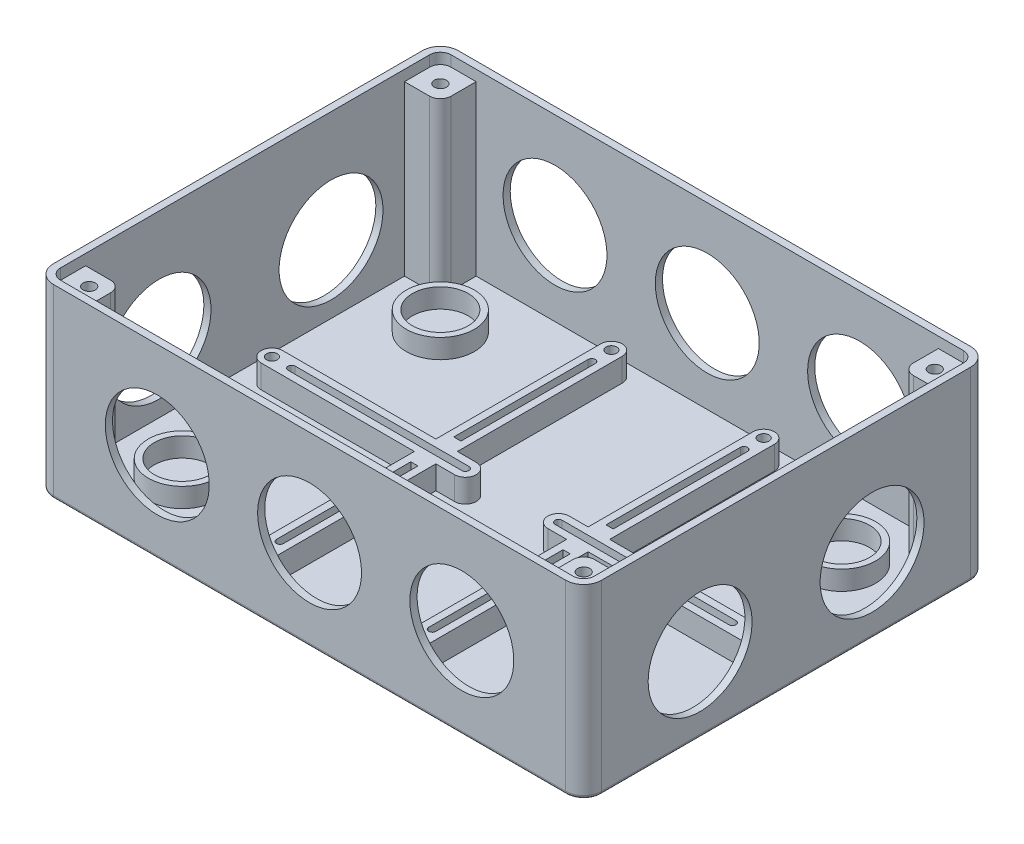
from build123d import *

# Parameters (mm, degrees)
BOSS_EXTRUDE1_DEPTH     = 52
FILLET1_R               = 1
SHELL1_T                = -2
SKETCH2_R               = 4
BOSS_EXTRUDE2_DEPTH     = 2.5
SKETCH3_R               = 14.5
CUT_EXTRUDE1_DEPTH      = 147.031674646
CUT_EXTRUDE2_DEPTH      = 109.390497739
CUT_EXTRUDE2_DEPTH_BACK = 109.390497739
SKETCH4_R               = 14.5
SKETCH5_W               = 93
SKETCH5_H               = 56
SKETCH5_W_2             = 89
SKETCH5_H_2             = 52
SKETCH5_W_3             = 61
SKETCH5_H_3             = 23
SKETCH5_W_4             = 57
SKETCH5_H_4             = 19
BOSS_EXTRUDE3_DEPTH     = 2.5
EXTRUDE_THIN1_START     = -2.5
EXTRUDE_THIN1_DEPTH     = 2.5
EXTRUDE_THIN2_START     = -2.5
EXTRUDE_THIN2_DEPTH     = 2.5
SKETCH8_R               = 9.5
SKETCH8_R_2             = 7.8
EXTRUDE_THIN3_DEPTH     = 5.4
SKETCH9_R               = 1.5
BOSS_EXTRUDE4_DEPTH     = 6.5
CUT_EXTRUDE3_DEPTH      = 6.5
CUT_EXTRUDE4_DEPTH      = 6.5
SKETCH12_R              = 1.7
BOSS_EXTRUDE5_DEPTH     = 47


with BuildPart() as part:
    # Sketch1 → Boss-Extrude1 (new body)
    with BuildSketch(Plane(origin=(0, 0, 0), x_dir=(1, 0, 0), z_dir=(0, 1, 0))):
        with BuildLine():
            Line((76.5, -51.5), (76.5, 51.5))
            ThreePointArc((76.5, 51.5), (75.035533906, 55.035533906), (71.5, 56.5))
            Line((71.5, 56.5), (-71.5, 56.5))
            ThreePointArc((-71.5, 56.5), (-75.035533906, 55.035533906), (-76.5, 51.5))
            Line((-76.5, 51.5), (-76.5, -51.5))
            ThreePointArc((-76.5, -51.5), (-75.035533906, -55.035533906), (-71.5, -56.5))
            Line((-71.5, -56.5), (71.5, -56.5))
            ThreePointArc((71.5, -56.5), (75.035533906, -55.035533906), (76.5, -51.5))
        make_face()
    extrude(amount=BOSS_EXTRUDE1_DEPTH)

    # Fillet1
    fillet1_edges = [part.edges().sort_by_distance(p)[0] for p in [
        (0, 0, -56.5),
        (75.035533906, 0, -55.035533906),
        (76.5, 0, 0),
        (75.035533906, 0, 55.035533906),
        (0, 0, 56.5),
        (-75.035533906, 0, 55.035533906),
        (-76.5, 0, 0),
        (-75.035533906, 0, -55.035533906),
    ]]
    fillet(fillet1_edges, radius=FILLET1_R)

    # Shell1
    shell1_openings = [part.faces().sort_by_distance(p)[0] for p in [
        (0, 52, 0),
    ]]
    offset(amount=SHELL1_T, openings=shell1_openings, kind=Kind.INTERSECTION)

    # Sketch2 → Boss-Extrude2 (add)
    with BuildSketch(Plane.XZ):
        with BuildLine():
            Line((56, 45), (-56, 45))
            ThreePointArc((-56, 45), (-62.363961031, 42.363961031), (-65, 36))
            Line((-65, 36), (-65, -36))
            ThreePointArc((-65, -36), (-62.363961031, -42.363961031), (-56, -45))
            Line((-56, -45), (56, -45))
            ThreePointArc((56, -45), (62.363961031, -42.363961031), (65, -36))
            Line((65, -36), (65, 36))
            ThreePointArc((65, 36), (62.363961031, 42.363961031), (56, 45))
        make_face()
        with Locations(Location((56, 36, 0), (0, 0, 270))):
            Circle(SKETCH2_R, mode=Mode.SUBTRACT)
        with Locations(Location((56, -36, 0), (0, 0, 90))):
            Circle(SKETCH2_R, mode=Mode.SUBTRACT)
        with Locations(Location((-56, -36, 0), (0, 0, 270))):
            Circle(SKETCH2_R, mode=Mode.SUBTRACT)
        with Locations(Location((-56, 36, 0), (0, 0, 90))):
            Circle(SKETCH2_R, mode=Mode.SUBTRACT)
        with BuildLine():
            Line((50.343145751, 43), (-50.343145751, 43))
            ThreePointArc((-50.343145751, 43), (-49.636038969, 29.636038969), (-63, 30.343145751))
            Line((-63, 30.343145751), (-63, -30.343145751))
            ThreePointArc((-63, -30.343145751), (-49.636038969, -29.636038969), (-50.343145751, -43))
            Line((-50.343145751, -43), (50.343145751, -43))
            ThreePointArc((50.343145751, -43), (49.636038969, -29.636038969), (63, -30.343145751))
            Line((63, -30.343145751), (63, 30.343145751))
            ThreePointArc((63, 30.343145751), (49.636038969, 29.636038969), (50.343145751, 43))
        make_face(mode=Mode.SUBTRACT)
    extrude(amount=BOSS_EXTRUDE2_DEPTH)

    # Sketch3 → Cut-Extrude1 (cut, through all)
    with BuildSketch(Plane(origin=(0, 0, -56.5), x_dir=(-1, 0, 0), z_dir=(0, 0, -1))):
        with Locations((-42.5, 25.3)):
            Circle(SKETCH3_R)
        with Locations((0, 25.3)):
            Circle(SKETCH3_R)
        with Locations((42.5, 25.3)):
            Circle(SKETCH3_R)
    extrude(amount=-CUT_EXTRUDE1_DEPTH, mode=Mode.SUBTRACT)

    # Sketch4 → Cut-Extrude2 (cut, two sides: drawn at the far end of the back side and taken through both)
    with BuildSketch(Plane(origin=(0, 0, 0), x_dir=(0, 0, -1), z_dir=(1, 0, 0)).offset(-CUT_EXTRUDE2_DEPTH_BACK)):
        with Locations((24, 21)):
            Circle(SKETCH4_R)
        with Locations(Location((-24, 21, 0), (0, 0, 180))):
            Circle(SKETCH4_R)
    extrude(amount=CUT_EXTRUDE2_DEPTH + CUT_EXTRUDE2_DEPTH_BACK, mode=Mode.SUBTRACT)

    # Sketch5 → Boss-Extrude3 (add)
    # profile 1 of 2: a face of its own
    with BuildSketch(Plane.XZ):
        Rectangle(SKETCH5_W, SKETCH5_H)
        Rectangle(SKETCH5_W_2, SKETCH5_H_2, mode=Mode.SUBTRACT)
    # profile 2 of 2: a face of its own
    with BuildSketch(Plane.XZ):
        Rectangle(SKETCH5_W_3, SKETCH5_H_3)
        Rectangle(SKETCH5_W_4, SKETCH5_H_4, mode=Mode.SUBTRACT)
    extrude(amount=BOSS_EXTRUDE3_DEPTH)

    # Sketch6 → Extrude-Thin1 (add)
    with BuildSketch(Plane.XZ.offset(2.5).offset(EXTRUDE_THIN1_START)):
        Polygon((29.193893241, 8.779922108), (53.813581674, 32.504349144), (52.425795192, 33.944504927), (27.806106759, 10.220077892), align=None)
    extrude_thin1 = extrude(amount=EXTRUDE_THIN1_DEPTH)

    # Sketch7 → Extrude-Thin2 (add)
    with BuildSketch(Plane.XZ.offset(2.5).offset(EXTRUDE_THIN2_START)):
        Polygon((27.806106759, -10.220077892), (52.425795192, -33.944504927), (53.813581674, -32.504349144), (29.193893241, -8.779922108), align=None)
    extrude_thin2 = extrude(amount=EXTRUDE_THIN2_DEPTH)

    # Mirror1: Extrude-Thin1, Extrude-Thin2 across plane
    add(extrude_thin1.mirror(Plane(origin=(0, 0, 0), x_dir=(0, 0, 1), z_dir=(1, 0, 0))))
    add(extrude_thin2.mirror(Plane(origin=(0, 0, 0), x_dir=(0, 0, 1), z_dir=(1, 0, 0))))

    # Sketch8 → Extrude-Thin3 (add)
    # profile 1 of 4: a face of its own
    with BuildSketch(Plane(origin=(0, 2, 0), x_dir=(1, 0, 0), z_dir=(0, 1, 0))):
        with Locations((56, 36)):
            Circle(SKETCH8_R)
        with Locations((56, 36)):
            Circle(SKETCH8_R_2, mode=Mode.SUBTRACT)
    # profile 2 of 4: a face of its own
    with BuildSketch(Plane(origin=(0, 2, 0), x_dir=(1, 0, 0), z_dir=(0, 1, 0))):
        with Locations((-56, 36)):
            Circle(SKETCH8_R)
        with Locations((-56, 36)):
            Circle(SKETCH8_R_2, mode=Mode.SUBTRACT)
    # profile 3 of 4: a face of its own
    with BuildSketch(Plane(origin=(0, 2, 0), x_dir=(1, 0, 0), z_dir=(0, 1, 0))):
        with Locations((56, -36)):
            Circle(SKETCH8_R)
        with Locations((56, -36)):
            Circle(SKETCH8_R_2, mode=Mode.SUBTRACT)
    # profile 4 of 4: a face of its own
    with BuildSketch(Plane(origin=(0, 2, 0), x_dir=(1, 0, 0), z_dir=(0, 1, 0))):
        with Locations((-56, -36)):
            Circle(SKETCH8_R)
        with Locations((-56, -36)):
            Circle(SKETCH8_R_2, mode=Mode.SUBTRACT)
    extrude(amount=EXTRUDE_THIN3_DEPTH)

    # Sketch9 → Boss-Extrude4 (add)
    # profile 1 of 2: a face of its own
    with BuildSketch(Plane(origin=(0, 2, 0), x_dir=(1, 0, 0), z_dir=(0, 1, 0))):
        with BuildLine():
            Line((13, 3), (18.25, 3))
            Line((18.25, 3), (18.25, 49))
            ThreePointArc((18.25, 49), (21.25, 52), (24.25, 49))
            Line((24.25, 49), (24.25, 3))
            Line((24.25, 3), (67, 3))
            ThreePointArc((67, 3), (70, 0), (67, -3))
            Line((67, -3), (24.25, -3))
            Line((24.25, -3), (24.25, -49))
            ThreePointArc((24.25, -49), (21.25, -52), (18.25, -49))
            Line((18.25, -49), (18.25, -3))
            Line((18.25, -3), (13, -3))
            ThreePointArc((13, -3), (10, 0), (13, 3))
        make_face()
        with Locations(Location((67, 0, 0), (0, 0, 90))):
            Circle(SKETCH9_R, mode=Mode.SUBTRACT)
        with Locations(Location((21.25, 49, 0), (0, 0, 90))):
            Circle(SKETCH9_R, mode=Mode.SUBTRACT)
        with Locations(Location((21.25, -49, 0), (0, 0, 90))):
            Circle(SKETCH9_R, mode=Mode.SUBTRACT)
    # profile 2 of 2: a face of its own
    with BuildSketch(Plane(origin=(0, 2, 0), x_dir=(1, 0, 0), z_dir=(0, 1, 0))):
        with BuildLine():
            Line((-24.25, -3), (-24.25, -49))
            ThreePointArc((-24.25, -49), (-21.25, -52), (-18.25, -49))
            Line((-18.25, -49), (-18.25, -3))
            Line((-18.25, -3), (-13, -3))
            ThreePointArc((-13, -3), (-10, 0), (-13, 3))
            Line((-13, 3), (-18.25, 3))
            Line((-18.25, 3), (-18.25, 49))
            ThreePointArc((-18.25, 49), (-21.25, 52), (-24.25, 49))
            Line((-24.25, 49), (-24.25, 3))
            Line((-24.25, 3), (-67, 3))
            ThreePointArc((-67, 3), (-70, 0), (-67, -3))
            Line((-67, -3), (-24.25, -3))
        make_face()
        with Locations(Location((-67, 0, 0), (0, 0, 90))):
            Circle(SKETCH9_R, mode=Mode.SUBTRACT)
        with Locations(Location((-21.25, 49, 0), (0, 0, 90))):
            Circle(SKETCH9_R, mode=Mode.SUBTRACT)
        with Locations(Location((-21.25, -49, 0), (0, 0, 90))):
            Circle(SKETCH9_R, mode=Mode.SUBTRACT)
    extrude(amount=BOSS_EXTRUDE4_DEPTH)

    # Sketch10 → Cut-Extrude3 (cut)
    with BuildSketch(Plane(origin=(0, 8.5, 0), x_dir=(1, 0, 0), z_dir=(0, 1, 0))):
        with BuildLine():
            Line((13, 1), (61.5, 1))
            ThreePointArc((61.5, 1), (62.5, 0), (61.5, -1))
            Line((61.5, -1), (13, -1))
            ThreePointArc((13, -1), (12, 0), (13, 1))
        make_face()
        with BuildLine():
            Line((-13, 1), (-61.5, 1))
            ThreePointArc((-61.5, 1), (-62.5, 0), (-61.5, -1))
            Line((-61.5, -1), (-13, -1))
            ThreePointArc((-13, -1), (-12, 0), (-13, 1))
        make_face()
    extrude(amount=-CUT_EXTRUDE3_DEPTH, mode=Mode.SUBTRACT)

    # Sketch11 → Cut-Extrude4 (cut)
    with BuildSketch(Plane(origin=(0, 8.5, 0), x_dir=(1, 0, 0), z_dir=(0, 1, 0))):
        with BuildLine():
            Line((22.25, 43.5), (22.25, 6))
            Line((22.25, 6), (20.25, 6))
            Line((20.25, 6), (20.25, 43.5))
            ThreePointArc((20.25, 43.5), (21.25, 44.5), (22.25, 43.5))
        make_face()
        with BuildLine():
            Line((20.25, -43.5), (20.25, -6))
            Line((20.25, -6), (22.25, -6))
            Line((22.25, -6), (22.25, -43.5))
            ThreePointArc((22.25, -43.5), (21.25, -44.5), (20.25, -43.5))
        make_face()
        with BuildLine():
            Line((-20.25, -43.5), (-20.25, -6))
            Line((-20.25, -6), (-22.25, -6))
            Line((-22.25, -6), (-22.25, -43.5))
            ThreePointArc((-22.25, -43.5), (-21.25, -44.5), (-20.25, -43.5))
        make_face()
        with BuildLine():
            Line((-20.25, 43.5), (-20.25, 6))
            Line((-20.25, 6), (-22.25, 6))
            Line((-22.25, 6), (-22.25, 43.5))
            ThreePointArc((-22.25, 43.5), (-21.25, 44.5), (-20.25, 43.5))
        make_face()
    extrude(amount=-CUT_EXTRUDE4_DEPTH, mode=Mode.SUBTRACT)

    # Sketch12 → Boss-Extrude5 (add)
    # profile 1 of 4: a face of its own
    with BuildSketch(Plane(origin=(0, 2, 0), x_dir=(1, 0, 0), z_dir=(0, 1, 0))):
        with BuildLine():
            Line((64.5, 54.5), (64.5, 47.5))
            ThreePointArc((64.5, 47.5), (65.378679656, 45.378679656), (67.5, 44.5))
            Line((67.5, 44.5), (74.5, 44.5))
            Line((74.5, 44.5), (74.5, 51.5))
            ThreePointArc((74.5, 51.5), (73.621320344, 53.621320344), (71.5, 54.5))
            Line((71.5, 54.5), (64.5, 54.5))
        make_face()
        with Locations(Location((69, 49, 0), (0, 0, 270))):
            Circle(SKETCH12_R, mode=Mode.SUBTRACT)
    # profile 2 of 4: a face of its own
    with BuildSketch(Plane(origin=(0, 2, 0), x_dir=(1, 0, 0), z_dir=(0, 1, 0))):
        with BuildLine():
            Line((64.5, -54.5), (71.5, -54.5))
            ThreePointArc((71.5, -54.5), (73.621320344, -53.621320344), (74.5, -51.5))
            Line((74.5, -51.5), (74.5, -44.5))
            Line((74.5, -44.5), (67.5, -44.5))
            ThreePointArc((67.5, -44.5), (65.378679656, -45.378679656), (64.5, -47.5))
            Line((64.5, -47.5), (64.5, -54.5))
        make_face()
        with Locations(Location((69, -49, 0), (0, 0, 90))):
            Circle(SKETCH12_R, mode=Mode.SUBTRACT)
    # profile 3 of 4: a face of its own
    with BuildSketch(Plane(origin=(0, 2, 0), x_dir=(1, 0, 0), z_dir=(0, 1, 0))):
        with BuildLine():
            Line((-64.5, -54.5), (-64.5, -47.5))
            ThreePointArc((-64.5, -47.5), (-65.378679656, -45.378679656), (-67.5, -44.5))
            Line((-67.5, -44.5), (-74.5, -44.5))
            Line((-74.5, -44.5), (-74.5, -51.5))
            ThreePointArc((-74.5, -51.5), (-73.621320344, -53.621320344), (-71.5, -54.5))
            Line((-71.5, -54.5), (-64.5, -54.5))
        make_face()
        with Locations(Location((-69, -49, 0), (0, 0, 270))):
            Circle(SKETCH12_R, mode=Mode.SUBTRACT)
    # profile 4 of 4: a face of its own
    with BuildSketch(Plane(origin=(0, 2, 0), x_dir=(1, 0, 0), z_dir=(0, 1, 0))):
        with BuildLine():
            Line((-64.5, 54.5), (-71.5, 54.5))
            ThreePointArc((-71.5, 54.5), (-73.621320344, 53.621320344), (-74.5, 51.5))
            Line((-74.5, 51.5), (-74.5, 44.5))
            Line((-74.5, 44.5), (-67.5, 44.5))
            ThreePointArc((-67.5, 44.5), (-65.378679656, 45.378679656), (-64.5, 47.5))
            Line((-64.5, 47.5), (-64.5, 54.5))
        make_face()
        with Locations(Location((-69, 49, 0), (0, 0, 90))):
            Circle(SKETCH12_R, mode=Mode.SUBTRACT)
    extrude(amount=BOSS_EXTRUDE5_DEPTH)


solid = part.part
